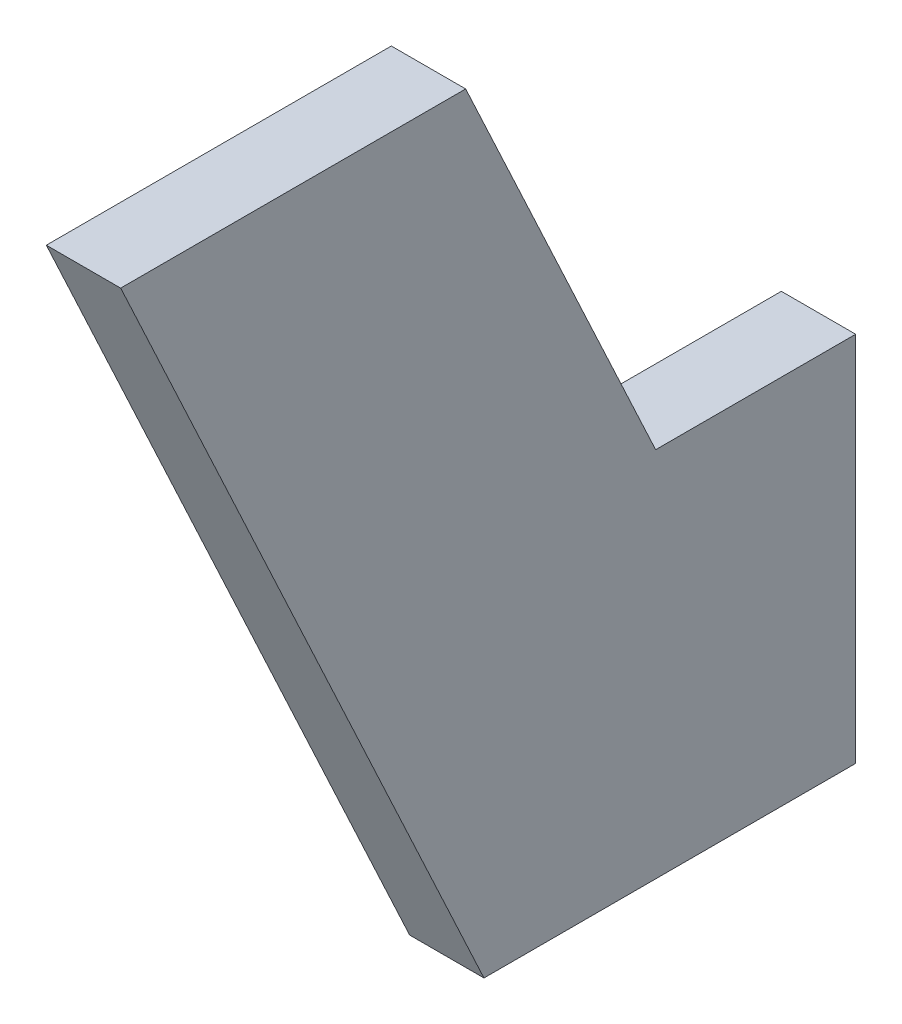
from build123d import *

# Parameters (mm, degrees)
SKETCH_1_W      = 16
SKETCH_1_H      = 80
SKETCH_1_R      = 2.25
EXTRUDE_1_DEPTH = 80
EXTRUDE_2_DEPTH = 16


with BuildPart() as part:
    # 草图1 → 凸台-拉伸1 (new body)
    with BuildSketch(Plane.XY):
        Rectangle(SKETCH_1_W, SKETCH_1_H)
        with Locations((0, 32)):
            Circle(SKETCH_1_R, mode=Mode.SUBTRACT)
        Circle(SKETCH_1_R, mode=Mode.SUBTRACT)
        with Locations((0, -32)):
            Circle(SKETCH_1_R, mode=Mode.SUBTRACT)
    extrude(amount=EXTRUDE_1_DEPTH)

    # 草图2 → 凸台-拉伸2 (add)
    with BuildSketch(Plane(origin=(8, 0, 0), x_dir=(0, 0, -1), z_dir=(1, 0, 0))):
        Polygon((-80, -40), (-100.37264984, 3.68928857), (-158.198670132, 127.697589274), (-83.944773743, 127.697589274), (-43.050716263, 40), align=None)
    extrude(amount=-EXTRUDE_2_DEPTH)


solid = part.part
